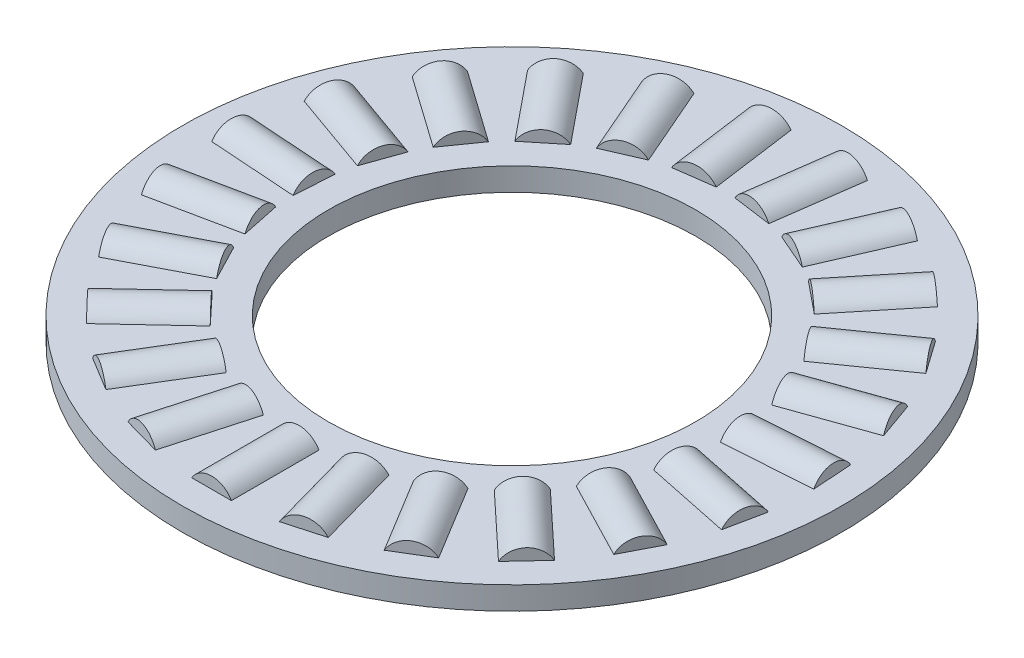
from build123d import *

# Parameters (mm, degrees)
SKETCH5_W         = 6.3246
SKETCH5_H         = 0.9921875
SKETCH3_W         = 3.79476
SKETCH3_H         = 0.9921875
SKETCH2_W         = 3.79476
SKETCH2_H         = 0.9921875
CIRPATTERN1_COUNT = 23
CIRPATTERN1_ANGLE = 344.347826087
CIRPATTERN2_COUNT = 23


with BuildPart() as part:
    # Sketch5 → Revolve3 (revolve)
    with BuildSketch(Plane(origin=(0, 0, 0), x_dir=(0, 0, -1), z_dir=(1, 0, 0)), mode=Mode.PRIVATE) as revolve3_sk:
        with Locations((-11.1252, 0)):
            Rectangle(SKETCH5_W, SKETCH5_H)
    revolve(revolve3_sk.sketch.rotate(Axis((0, -0.9921875, 0), (0, 1, 0)), 180), axis=Axis((0, -0.9921875, 0), (0, 1, 0)))

    # Sketch3 → Cut-Revolve1 (revolve, cut)
    with BuildSketch(Plane(origin=(0, 0, 0), x_dir=(0, 0, -1), z_dir=(1, 0, 0))):
        with Locations((-11.1252, 0.49609375)):
            Rectangle(SKETCH3_W, SKETCH3_H)
    cut_revolve1 = revolve(axis=Axis((0, 0, 13.02258), (0, 0, -1)), mode=Mode.SUBTRACT)

    # CirPattern2: Cut-Revolve1 ×23 about axis
    cirpattern2_axis = Axis((0, 0, 0), (0, 1, 0))
    for i in range(1, CIRPATTERN2_COUNT):
        add(cut_revolve1.rotate(cirpattern2_axis, i * 360 / CIRPATTERN2_COUNT), mode=Mode.SUBTRACT)


with BuildPart() as body_2:
    # Sketch2 → Revolve2 (revolve)
    with BuildSketch(Plane(origin=(0, 0, 0), x_dir=(0, 0, -1), z_dir=(1, 0, 0)), mode=Mode.PRIVATE) as revolve2_sk:
        with Locations((-11.1252, 0.49609375)):
            Rectangle(SKETCH2_W, SKETCH2_H)
    revolve(revolve2_sk.sketch.rotate(Axis((0, 0, 13.02258), (0, 0, -1)), 90), axis=Axis((0, 0, 13.02258), (0, 0, -1)))


with BuildPart() as cirpattern1_1:
    # CirPattern1: pattern copy
    add(body_2.part.rotate(Axis((0, 0.9921875, 0), (0, -1, 0)), 1 * CIRPATTERN1_ANGLE / (CIRPATTERN1_COUNT - 1)))


with BuildPart() as cirpattern1_2:
    # CirPattern1: pattern copy
    add(body_2.part.rotate(Axis((0, 0.9921875, 0), (0, -1, 0)), 2 * CIRPATTERN1_ANGLE / (CIRPATTERN1_COUNT - 1)))


with BuildPart() as cirpattern1_3:
    # CirPattern1: pattern copy
    add(body_2.part.rotate(Axis((0, 0.9921875, 0), (0, -1, 0)), 3 * CIRPATTERN1_ANGLE / (CIRPATTERN1_COUNT - 1)))


with BuildPart() as cirpattern1_4:
    # CirPattern1: pattern copy
    add(body_2.part.rotate(Axis((0, 0.9921875, 0), (0, -1, 0)), 4 * CIRPATTERN1_ANGLE / (CIRPATTERN1_COUNT - 1)))


with BuildPart() as cirpattern1_5:
    # CirPattern1: pattern copy
    add(body_2.part.rotate(Axis((0, 0.9921875, 0), (0, -1, 0)), 5 * CIRPATTERN1_ANGLE / (CIRPATTERN1_COUNT - 1)))


with BuildPart() as cirpattern1_6:
    # CirPattern1: pattern copy
    add(body_2.part.rotate(Axis((0, 0.9921875, 0), (0, -1, 0)), 6 * CIRPATTERN1_ANGLE / (CIRPATTERN1_COUNT - 1)))


with BuildPart() as cirpattern1_7:
    # CirPattern1: pattern copy
    add(body_2.part.rotate(Axis((0, 0.9921875, 0), (0, -1, 0)), 7 * CIRPATTERN1_ANGLE / (CIRPATTERN1_COUNT - 1)))


with BuildPart() as cirpattern1_8:
    # CirPattern1: pattern copy
    add(body_2.part.rotate(Axis((0, 0.9921875, 0), (0, -1, 0)), 8 * CIRPATTERN1_ANGLE / (CIRPATTERN1_COUNT - 1)))


with BuildPart() as cirpattern1_9:
    # CirPattern1: pattern copy
    add(body_2.part.rotate(Axis((0, 0.9921875, 0), (0, -1, 0)), 9 * CIRPATTERN1_ANGLE / (CIRPATTERN1_COUNT - 1)))


with BuildPart() as cirpattern1_10:
    # CirPattern1: pattern copy
    add(body_2.part.rotate(Axis((0, 0.9921875, 0), (0, -1, 0)), 10 * CIRPATTERN1_ANGLE / (CIRPATTERN1_COUNT - 1)))


with BuildPart() as cirpattern1_11:
    # CirPattern1: pattern copy
    add(body_2.part.rotate(Axis((0, 0.9921875, 0), (0, -1, 0)), 11 * CIRPATTERN1_ANGLE / (CIRPATTERN1_COUNT - 1)))


with BuildPart() as cirpattern1_12:
    # CirPattern1: pattern copy
    add(body_2.part.rotate(Axis((0, 0.9921875, 0), (0, -1, 0)), 12 * CIRPATTERN1_ANGLE / (CIRPATTERN1_COUNT - 1)))


with BuildPart() as cirpattern1_13:
    # CirPattern1: pattern copy
    add(body_2.part.rotate(Axis((0, 0.9921875, 0), (0, -1, 0)), 13 * CIRPATTERN1_ANGLE / (CIRPATTERN1_COUNT - 1)))


with BuildPart() as cirpattern1_14:
    # CirPattern1: pattern copy
    add(body_2.part.rotate(Axis((0, 0.9921875, 0), (0, -1, 0)), 14 * CIRPATTERN1_ANGLE / (CIRPATTERN1_COUNT - 1)))


with BuildPart() as cirpattern1_15:
    # CirPattern1: pattern copy
    add(body_2.part.rotate(Axis((0, 0.9921875, 0), (0, -1, 0)), 15 * CIRPATTERN1_ANGLE / (CIRPATTERN1_COUNT - 1)))


with BuildPart() as cirpattern1_16:
    # CirPattern1: pattern copy
    add(body_2.part.rotate(Axis((0, 0.9921875, 0), (0, -1, 0)), 16 * CIRPATTERN1_ANGLE / (CIRPATTERN1_COUNT - 1)))


with BuildPart() as cirpattern1_17:
    # CirPattern1: pattern copy
    add(body_2.part.rotate(Axis((0, 0.9921875, 0), (0, -1, 0)), 17 * CIRPATTERN1_ANGLE / (CIRPATTERN1_COUNT - 1)))


with BuildPart() as cirpattern1_18:
    # CirPattern1: pattern copy
    add(body_2.part.rotate(Axis((0, 0.9921875, 0), (0, -1, 0)), 18 * CIRPATTERN1_ANGLE / (CIRPATTERN1_COUNT - 1)))


with BuildPart() as cirpattern1_19:
    # CirPattern1: pattern copy
    add(body_2.part.rotate(Axis((0, 0.9921875, 0), (0, -1, 0)), 19 * CIRPATTERN1_ANGLE / (CIRPATTERN1_COUNT - 1)))


with BuildPart() as cirpattern1_20:
    # CirPattern1: pattern copy
    add(body_2.part.rotate(Axis((0, 0.9921875, 0), (0, -1, 0)), 20 * CIRPATTERN1_ANGLE / (CIRPATTERN1_COUNT - 1)))


with BuildPart() as cirpattern1_21:
    # CirPattern1: pattern copy
    add(body_2.part.rotate(Axis((0, 0.9921875, 0), (0, -1, 0)), 21 * CIRPATTERN1_ANGLE / (CIRPATTERN1_COUNT - 1)))


with BuildPart() as cirpattern1_22:
    # CirPattern1: pattern copy
    add(body_2.part.rotate(Axis((0, 0.9921875, 0), (0, -1, 0)), 22 * CIRPATTERN1_ANGLE / (CIRPATTERN1_COUNT - 1)))


solid = Compound([part.part, body_2.part, cirpattern1_1.part, cirpattern1_2.part, cirpattern1_3.part, cirpattern1_4.part, cirpattern1_5.part, cirpattern1_6.part, cirpattern1_7.part, cirpattern1_8.part, cirpattern1_9.part, cirpattern1_10.part, cirpattern1_11.part, cirpattern1_12.part, cirpattern1_13.part, cirpattern1_14.part, cirpattern1_15.part, cirpattern1_16.part, cirpattern1_17.part, cirpattern1_18.part, cirpattern1_19.part, cirpattern1_20.part, cirpattern1_21.part, cirpattern1_22.part])
